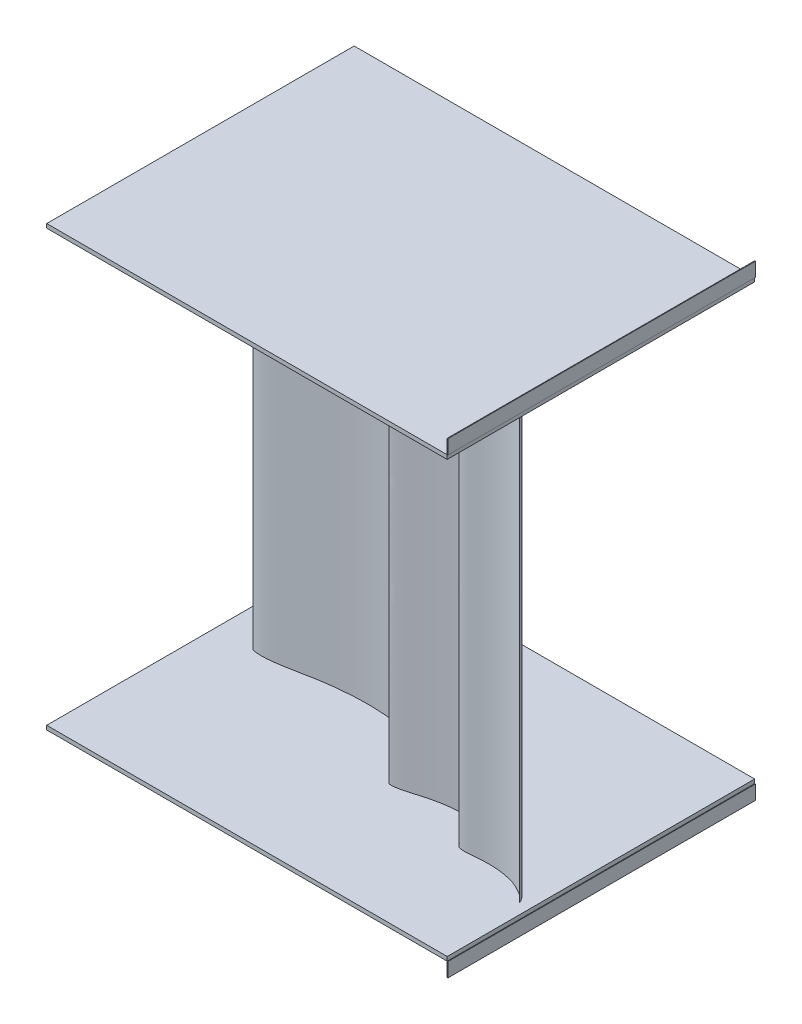
from build123d import *

# Parameters (mm, degrees)
SKETCH7_W             = 787.4
SKETCH7_H             = 604.52
BOSS_EXTRUDE10_DEPTH  = 8
SKETCH10_W            = 1.27
SKETCH10_H            = 604.52
EXTRUDE_THIN1_DEPTH   = 28
BOSS_EXTRUDE8_DEPTH   = 423.165
BOSS_EXTRUDE8_2_DEPTH = 423.165
BOSS_EXTRUDE8_3_DEPTH = 423.165


with BuildPart() as part:
    # Sketch7 → Boss-Extrude10 (new body)
    with BuildSketch(Plane(origin=(0, -431.165, 0), x_dir=(1, 0, 0), z_dir=(0, 1, 0))):
        with Locations((1635.15, -891.39)):
            Rectangle(SKETCH7_W, SKETCH7_H)
    extrude(amount=BOSS_EXTRUDE10_DEPTH)


with BuildPart() as body_2:
    # Sketch10 → Extrude-Thin1 (new body)
    with BuildSketch(Plane(origin=(0, -431.165, 0), x_dir=(1, 0, 0), z_dir=(0, 1, 0))):
        with Locations((2029.485, -891.39)):
            Rectangle(SKETCH10_W, SKETCH10_H)
    extrude(amount=-EXTRUDE_THIN1_DEPTH)


with BuildPart() as body_3:
    # Sketch8 → Boss-Extrude8 (new body)
    with BuildSketch(Plane(origin=(0, 0, 0), x_dir=(1, 0, 0), z_dir=(0, 1, 0))):
        with BuildLine():
            add(Edge.make_bspline(
                [(1676.223645231, -953.14898116), (1676.248508517, -952.823118075), (1676.298611544, -952.166458019), (1676.513196004, -951.187762742), (1676.829208496, -950.208835252), (1677.25637938, -949.227625696), (1677.791055972, -948.241521318), (1678.433356312, -947.248262064), (1679.182336331, -946.245882785), (1680.03734564, -945.232886883), (1680.997586788, -944.208299611), (1682.06220163, -943.171712889), (1683.230217195, -942.123302689), (1684.500543999, -941.063831428), (1685.871968022, -939.994637546), (1687.343150149, -938.917612884), (1688.912627259, -937.835169311), (1690.578815096, -936.750194869), (1692.340013179, -935.666001169), (1694.194407048, -934.586258263), (1696.14007544, -933.514927699), (1698.174993183, -932.45618329), (1700.297037784, -931.414332042), (1703.278410338, -930.035603138), (1707.208201868, -928.383622165), (1712.176217772, -926.560628741), (1716.517165062, -925.190554331), (1721.06969434, -923.919700166), (1724.841313656, -923.002005561), (1729.702381746, -921.979803058), (1734.737738875, -921.082158021), (1740.936332451, -920.215366906), (1746.219538682, -919.656314347), (1750.525929003, -919.295337438), (1753.807850357, -919.064889582), (1757.12155907, -918.873639774), (1760.463910355, -918.718987206), (1763.831730564, -918.598345139), (1767.221816129, -918.509221677), (1770.630933216, -918.449298875), (1774.05581721, -918.416511403), (1777.493173053, -918.409107807), (1782.09178083, -918.43128741), (1786.695818413, -918.499581485), (1791.300387742, -918.612547766), (1794.749648561, -918.721787809), (1798.191195671, -918.850634395), (1801.621845547, -919.023030396), (1805.033816623, -919.312642062), (1808.42447133, -919.694023237), (1811.790575279, -920.164944551), (1815.129197673, -920.716379976), (1818.437387417, -921.340819211), (1821.712245171, -922.030355712), (1824.95088947, -922.777478624), (1828.150453059, -923.575117575), (1831.308073784, -924.416851652), (1834.420890312, -925.297032368), (1837.486038879, -926.210886979), (1840.500653879, -927.154574468), (1843.461869792, -928.125205237), (1846.366825338, -929.120819915), (1849.212669272, -930.140327984), (1851.996568306, -931.183410024), (1854.715714803, -932.250388532), (1857.367336775, -933.342069149), (1859.948707482, -934.459560057), (1862.45715598, -935.60407605), (1864.890078481, -936.776731787), (1867.244949183, -937.978336775), (1869.519332636, -939.209192938), (1871.710896618, -940.468906962), (1873.817423668, -941.756224411), (1875.836824072, -943.068888789), (1877.767146459, -944.403534536), (1879.606587849, -945.755615734), (1881.353499776, -947.119375978), (1883.006392478, -948.487858077), (1884.563935543, -949.852954837), (1886.024954137, -951.205501046), (1887.797220612, -952.934131788), (1889.758801693, -954.990699237), (1892.016491851, -957.570442316), (1893.782138215, -959.768588407), (1894.979030644, -961.359539906), (1895.519158005, -962.097619563), (1895.774301262, -962.450663626), (1895.927431935, -962.664273144), (1895.99551792, -962.759699416), (1896.012575767, -962.783606932)],
                knots=[0, 0, 0, 0, 0.004018004, 0.008096844, 0.012294289, 0.016662584, 0.021246956, 0.026085061, 0.031207156, 0.036636683, 0.042391044, 0.048482393, 0.054918383, 0.061702826, 0.068836278, 0.076316544, 0.084139133, 0.092297662, 0.100784228, 0.109589757, 0.118704313, 0.128117401, 0.13781823, 0.147795954, 0.168539602, 0.190267252, 0.212905888, 0.224546433, 0.248433347, 0.260666031, 0.285676528, 0.311368314, 0.337682338, 0.351052217, 0.364551981, 0.378171871, 0.391901548, 0.405730116, 0.419646162, 0.433637803, 0.447692751, 0.461798364, 0.475941717, 0.504288898, 0.518466032, 0.532627656, 0.546760426, 0.560851801, 0.574897718, 0.588895404, 0.602839786, 0.616723549, 0.630537309, 0.644269913, 0.657908804, 0.671440457, 0.684850808, 0.698125672, 0.711251123, 0.724213822, 0.737001283, 0.749602075, 0.762005976, 0.774204054, 0.78618871, 0.797953651, 0.80949382, 0.820805253, 0.831884876, 0.842730218, 0.853339058, 0.863708983, 0.873836886, 0.883718414, 0.893347394, 0.902715279, 0.911810645, 0.920618786, 0.929121449, 0.937296719, 0.9451191, 0.959587072, 0.972264254, 0.987301179, 0.99427769, 0.996765345, 0.998557281, 0.99963855, 1, 1, 1, 1], degree=3))
            add(Edge.make_bspline(
                [(1896.012575767, -962.783606932), (1895.406108271, -961.981251513), (1894.525610697, -960.816354786), (1893.020166109, -959.473634815), (1891.95141706, -958.572815175), (1890.983489394, -957.615047027), (1889.930145969, -956.875333931), (1888.827154409, -956.06134552), (1887.548867429, -955.237517425), (1886.282522999, -954.294903774), (1884.723276336, -953.591355875), (1883.235195013, -952.669606729), (1881.630330044, -951.882238334), (1879.97306751, -951.058374307), (1878.294628507, -950.322892903), (1876.640310248, -949.547798047), (1875.064466368, -948.801245623), (1873.439801753, -948.068004121), (1871.755033673, -947.330648276), (1870.006899089, -946.594716844), (1868.208781824, -945.832569804), (1866.322925943, -945.08275469), (1864.335183936, -944.331601323), (1862.246667966, -943.575703932), (1860.043381221, -942.793960025), (1857.723676247, -942.055434755), (1855.339209461, -941.27192839), (1852.893583799, -940.50876702), (1850.390693067, -939.833574641), (1847.875994884, -939.166485208), (1845.358172989, -938.536928922), (1842.840694672, -937.942623999), (1840.315956742, -937.420454986), (1837.787507618, -936.966659322), (1835.26189299, -936.538253028), (1832.724498497, -936.229692535), (1830.196694703, -935.876305678), (1827.661559054, -935.598508546), (1825.122957409, -935.379313532), (1822.585239267, -935.178638192), (1820.047244639, -934.978303084), (1817.505340863, -934.863183594), (1814.963546418, -934.736730875), (1812.41968749, -934.689062974), (1809.876512993, -934.574975628), (1807.329571764, -934.568706561), (1804.780990253, -934.593091769), (1802.231520733, -934.637443114), (1799.681459161, -934.716283297), (1797.13080349, -934.809467905), (1794.576178629, -934.888995966), (1792.02367551, -935.06218139), (1789.468598076, -935.229592288), (1786.909632238, -935.392745345), (1784.35487952, -935.645655121), (1781.795635471, -935.884747249), (1779.231783491, -936.130235621), (1776.677078059, -936.483951013), (1774.110498608, -936.776345632), (1771.549831919, -937.130933735), (1768.983555884, -937.480988172), (1766.419047081, -937.880828468), (1763.852324187, -938.30909418), (1761.283554199, -938.758565105), (1758.71571749, -939.237471636), (1756.145988074, -939.724220739), (1753.590328662, -940.214044341), (1751.065608548, -940.783225469), (1748.570201184, -941.321840744), (1746.140880191, -941.882678592), (1743.787176739, -942.425858985), (1741.519296493, -942.993729831), (1739.307962225, -943.55928887), (1737.140019015, -944.143347827), (1735.014757571, -944.733219354), (1732.919909018, -945.286078616), (1730.890959026, -945.860661174), (1728.911257345, -946.467284808), (1726.936206075, -947.025079769), (1724.991375225, -947.613560944), (1723.065551081, -948.201526741), (1721.162736401, -948.784816312), (1719.227425393, -949.332611381), (1717.288196016, -949.934656202), (1715.313992462, -950.501428944), (1713.352394589, -951.102297675), (1711.380304796, -951.665965275), (1709.395675862, -952.252599545), (1707.366164454, -952.82770925), (1705.27994173, -953.413041526), (1703.112772334, -953.99096574), (1700.859571532, -954.533532892), (1698.515014852, -955.097855994), (1696.060719434, -955.603355076), (1693.533964532, -956.104483714), (1690.966854221, -956.543428554), (1688.405511493, -956.906909649), (1685.842066717, -957.129367476), (1683.293887702, -957.254836649), (1680.721811473, -957.261305317), (1678.77111711, -957.051423213), (1677.197097894, -956.860976979), (1676.657693201, -955.994402193), (1676.134030965, -954.818154504), (1676.187168697, -953.828400425), (1676.223645231, -953.14898116)],
                knots=[0, 0, 0, 0, 0.012969613, 0.018829885, 0.026053492, 0.031072711, 0.036411959, 0.042675167, 0.048818841, 0.056098654, 0.063029013, 0.07086949, 0.078731271, 0.086149516, 0.094824955, 0.102443262, 0.109795749, 0.117394239, 0.125513288, 0.133598644, 0.141944087, 0.150790562, 0.159864361, 0.169446736, 0.179539205, 0.190121069, 0.200953426, 0.212027043, 0.223274914, 0.234503092, 0.245701924, 0.25686608, 0.267981226, 0.279066442, 0.290115737, 0.301130877, 0.312145186, 0.32315148, 0.334135085, 0.345124319, 0.356101573, 0.367083907, 0.378056416, 0.389039746, 0.400012846, 0.411002081, 0.421999334, 0.433002579, 0.44400471, 0.455020626, 0.466039585, 0.47708247, 0.488130432, 0.499183673, 0.510267601, 0.521355417, 0.53245533, 0.543598587, 0.554732331, 0.56588871, 0.577056981, 0.588255725, 0.599481242, 0.610738121, 0.622008749, 0.633290144, 0.644591394, 0.655686241, 0.666785959, 0.677634095, 0.687956368, 0.698050747, 0.707893271, 0.717499459, 0.727111021, 0.736440914, 0.745541675, 0.754402961, 0.763239649, 0.772104051, 0.780701957, 0.789302509, 0.797863114, 0.806733775, 0.815582689, 0.824447091, 0.833286822, 0.842129605, 0.85123336, 0.86058942, 0.870175174, 0.88026153, 0.890586373, 0.901385732, 0.912691745, 0.92392719, 0.935090318, 0.946170428, 0.957198422, 0.968178171, 0.979173028, 0.983281921, 0.987500047, 0.991419375, 1, 1, 1, 1], degree=3))
        make_face()
    extrude(amount=-BOSS_EXTRUDE8_DEPTH)


with BuildPart() as body_4:
    # Sketch8 → Boss-Extrude8 2 (new body)
    with BuildSketch(Plane(origin=(0, 0, 0), x_dir=(1, 0, 0), z_dir=(0, 1, 0))):
        with BuildLine():
            add(Edge.make_bspline(
                [(2008.92647858, -1031.598430351), (2008.60933723, -1030.93928668), (2008.148896743, -1029.982311398), (2007.268440658, -1028.808798243), (2006.635857931, -1028.013058732), (2006.083335074, -1027.191198414), (2005.438596634, -1026.512532397), (2004.769129471, -1025.773781045), (2003.976098752, -1025.002837451), (2003.208643205, -1024.148921011), (2002.198026994, -1023.423377914), (2001.269487533, -1022.552489551), (2000.238386603, -1021.760634676), (1999.175170587, -1020.935234585), (1998.084162741, -1020.169805347), (1997.016041306, -1019.37959809), (1995.9997687, -1018.621011137), (1994.946777572, -1017.864902256), (1993.851526632, -1017.097227614), (1992.710893988, -1016.321467407), (1991.538391466, -1015.519837961), (1990.301564546, -1014.714398979), (1988.992290164, -1013.893372357), (1987.611850396, -1013.054489687), (1986.153297093, -1012.180695646), (1984.60553613, -1011.320993586), (1983.018063732, -1010.419920772), (1981.384066061, -1009.524568885), (1979.696606617, -1008.683709679), (1977.99956526, -1007.846931604), (1976.294906104, -1007.036464122), (1974.585428877, -1006.251178431), (1972.860415293, -1005.516279334), (1971.122935601, -1004.829593962), (1969.383830177, -1004.161417039), (1967.619113288, -1003.576992228), (1965.867672332, -1002.961985958), (1964.100147455, -1002.399818302), (1962.321734688, -1001.878933192), (1960.541291902, -1001.371378571), (1958.760603128, -1000.864026806), (1956.96488812, -1000.416868023), (1955.17087881, -999.961644923), (1953.364082051, -999.56229491), (1951.56731284, -999.115689485), (1949.752372591, -998.745412054), (1947.931860142, -998.396753986), (1946.107846925, -998.062203226), (1944.278458097, -997.752156234), (1942.44658547, -997.452250766), (1940.61384445, -997.142038787), (1938.769164459, -996.898904523), (1936.923478486, -996.651283575), (1935.075631815, -996.400068522), (1933.217897454, -996.2134506), (1931.358945579, -996.016336317), (1929.495789814, -995.823120413), (1927.623610822, -995.708378602), (1925.751773533, -995.54821275), (1923.875219122, -995.433236945), (1921.995316683, -995.314223214), (1920.10952363, -995.230958111), (1918.218069403, -995.167640894), (1916.322110073, -995.119147908), (1914.422588396, -995.091775068), (1912.520590913, -995.069721744), (1910.628183054, -995.051881206), (1908.746435523, -995.095062281), (1906.889976566, -995.120661528), (1905.077442111, -995.171596093), (1903.321355225, -995.220802456), (1901.622909758, -995.299938342), (1899.965110757, -995.38554752), (1898.335590316, -995.490578305), (1896.735664985, -995.605883386), (1895.162738447, -995.699168682), (1893.633674222, -995.817406363), (1892.135119617, -995.965561071), (1890.646893603, -996.079571319), (1889.175805877, -996.21979974), (1887.718342995, -996.362390585), (1886.27795633, -996.504952283), (1884.819499368, -996.617540863), (1883.350457112, -996.768243998), (1881.861546032, -996.888776705), (1880.376725084, -997.035428642), (1878.889766989, -997.154051132), (1877.3905705, -997.287246748), (1875.861030301, -997.405779624), (1874.289589564, -997.523455438), (1872.661501925, -997.624223601), (1870.977156438, -997.687427584), (1869.22455409, -997.75302135), (1867.402162234, -997.760915181), (1865.528738133, -997.755286013), (1863.635473893, -997.699526833), (1861.757160231, -997.590794184), (1859.897602575, -997.381217149), (1858.062858764, -997.10468466), (1856.228169053, -996.739878543), (1854.867566951, -996.310072053), (1853.772723729, -995.948222838), (1853.512618369, -995.252925984), (1853.308213781, -994.339109), (1853.488253081, -993.641096234), (1853.611841528, -993.161943555)],
                knots=[0, 0, 0, 0, 0.012969613, 0.018829885, 0.026053492, 0.031072711, 0.036411959, 0.042675167, 0.048818841, 0.056098654, 0.063029013, 0.07086949, 0.078731271, 0.086149516, 0.094824955, 0.102443262, 0.109795749, 0.117394239, 0.125513288, 0.133598644, 0.141944087, 0.150790562, 0.159864361, 0.169446736, 0.179539205, 0.190121069, 0.200953426, 0.212027043, 0.223274914, 0.234503092, 0.245701924, 0.25686608, 0.267981226, 0.279066442, 0.290115737, 0.301130877, 0.312145186, 0.32315148, 0.334135085, 0.345124319, 0.356101573, 0.367083907, 0.378056416, 0.389039746, 0.400012846, 0.411002081, 0.421999334, 0.433002579, 0.44400471, 0.455020626, 0.466039585, 0.47708247, 0.488130432, 0.499183673, 0.510267601, 0.521355417, 0.53245533, 0.543598587, 0.554732331, 0.56588871, 0.577056981, 0.588255725, 0.599481242, 0.610738121, 0.622008749, 0.633290144, 0.644591394, 0.655686241, 0.666785959, 0.677634095, 0.687956368, 0.698050747, 0.707893271, 0.717499459, 0.727111021, 0.736440914, 0.745541675, 0.754402961, 0.763239649, 0.772104051, 0.780701957, 0.789302509, 0.797863114, 0.806733775, 0.815582689, 0.824447091, 0.833286822, 0.842129605, 0.85123336, 0.86058942, 0.870175174, 0.88026153, 0.890586373, 0.901385732, 0.912691745, 0.92392719, 0.935090318, 0.946170428, 0.957198422, 0.968178171, 0.979173028, 0.983281921, 0.987500047, 0.991419375, 1, 1, 1, 1], degree=3))
            add(Edge.make_bspline(
                [(1853.611841528, -993.161943555), (1853.676370326, -992.933190632), (1853.806404952, -992.472221243), (1854.099959293, -991.805280852), (1854.465860057, -991.152742645), (1854.911338913, -990.514542715), (1855.434166944, -989.888293678), (1856.034752908, -989.272401181), (1856.712705978, -988.665328582), (1857.467777413, -988.065915467), (1858.299538668, -987.473352355), (1859.207436541, -986.887225055), (1860.190752077, -986.307519282), (1861.248599028, -985.73462212), (1862.379919621, -985.169313446), (1863.583487419, -984.612749714), (1864.857912881, -984.066440322), (1866.201651712, -983.532216759), (1867.613015923, -983.012195802), (1869.090184779, -982.508733407), (1870.631219532, -982.024378016), (1872.234076867, -981.561814478), (1873.896624956, -981.123808626), (1876.22021505, -980.569048142), (1879.259226245, -979.95569068), (1883.063000956, -979.369526355), (1886.354656258, -979.016206862), (1889.782908206, -978.764015151), (1892.603687709, -978.651449139), (1896.216199336, -978.620847831), (1899.935080522, -978.704082214), (1904.478859195, -978.976385307), (1908.325813486, -979.336616717), (1911.447898409, -979.69776956), (1913.820841211, -980.004842285), (1916.210816924, -980.344426744), (1918.615957018, -980.714217019), (1921.034370366, -981.111913073), (1923.464130887, -981.535278196), (1925.903265939, -981.982195345), (1928.349744652, -982.450723159), (1930.80146937, -982.939139683), (1934.076859227, -983.615433927), (1937.349497008, -984.325385328), (1940.61609779, -985.06726213), (1943.059557055, -985.640549555), (1945.494700817, -986.226707564), (1947.915820557, -986.842348979), (1950.306787996, -987.538876485), (1952.669377417, -988.29776943), (1955.001603062, -989.116973842), (1957.302671795, -989.989633679), (1959.571558311, -990.909970621), (1961.807331117, -991.871931277), (1964.009014628, -992.869746933), (1966.175580129, -993.897964958), (1968.305909261, -994.951596483), (1970.398773309, -996.026203459), (1972.452816045, -997.117971847), (1974.46654611, -998.223751621), (1976.438335552, -999.341071079), (1978.366425843, -1000.468122331), (1980.248940814, -1001.60371838), (1982.083906351, -1002.747224562), (1983.869274433, -1003.898467548), (1985.60295306, -1005.057623591), (1987.282839039, -1006.225091136), (1988.906853646, -1007.401352652), (1990.472980417, -1008.586828862), (1991.979302316, -1009.781734132), (1993.424039626, -1010.985933925), (1994.80558608, -1012.198812857), (1996.122540911, -1013.419158094), (1997.373738349, -1014.64506073), (1998.55827055, -1015.873841023), (1999.675504993, -1017.101999005), (2000.725093176, -1018.325193888), (2001.70697221, -1019.538251576), (2002.621357985, -1020.735200967), (2003.468729271, -1021.909338989), (2004.483988946, -1023.396309718), (2005.587120031, -1025.144273349), (2006.826220143, -1027.307763889), (2007.769325231, -1029.128524561), (2008.394146597, -1030.434698052), (2008.673222469, -1031.038488153), (2008.80442031, -1031.326836064), (2008.882914799, -1031.501122479), (2008.917750945, -1031.578935541), (2008.92647858, -1031.598430351)],
                knots=[0, 0, 0, 0, 0.004018004, 0.008096844, 0.012294289, 0.016662584, 0.021246956, 0.026085061, 0.031207156, 0.036636683, 0.042391044, 0.048482393, 0.054918383, 0.061702826, 0.068836278, 0.076316544, 0.084139133, 0.092297662, 0.100784228, 0.109589757, 0.118704313, 0.128117401, 0.13781823, 0.147795954, 0.168539602, 0.190267252, 0.212905888, 0.224546433, 0.248433347, 0.260666031, 0.285676528, 0.311368314, 0.337682338, 0.351052217, 0.364551981, 0.378171871, 0.391901548, 0.405730116, 0.419646162, 0.433637803, 0.447692751, 0.461798364, 0.475941717, 0.504288898, 0.518466032, 0.532627656, 0.546760426, 0.560851801, 0.574897718, 0.588895404, 0.602839786, 0.616723549, 0.630537309, 0.644269913, 0.657908804, 0.671440457, 0.684850808, 0.698125672, 0.711251123, 0.724213822, 0.737001283, 0.749602075, 0.762005976, 0.774204054, 0.78618871, 0.797953651, 0.80949382, 0.820805253, 0.831884876, 0.842730218, 0.853339058, 0.863708983, 0.873836886, 0.883718414, 0.893347394, 0.902715279, 0.911810645, 0.920618786, 0.929121449, 0.937296719, 0.9451191, 0.959587072, 0.972264254, 0.987301179, 0.99427769, 0.996765345, 0.998557281, 0.99963855, 1, 1, 1, 1], degree=3))
        make_face()
    extrude(amount=-BOSS_EXTRUDE8_2_DEPTH)


with BuildPart() as body_5:
    # Sketch8 → Boss-Extrude8 3 (new body)
    with BuildSketch(Plane(origin=(0, 0, 0), x_dir=(1, 0, 0), z_dir=(0, 1, 0))):
        with BuildLine():
            add(Edge.make_bspline(
                [(1314.075266142, -855), (1314.082536869, -855.118118311), (1314.161247856, -856.396836206), (1313.556629056, -858.307280968), (1314.377691946, -860.551987174), (1315.2321768, -862.322250522), (1318.227491231, -862.98940319), (1321.933479198, -863.766730794), (1326.880249726, -864.246846688), (1331.802314331, -864.493738462), (1336.772721177, -864.557083849), (1341.765984188, -864.348945445), (1346.784818701, -863.996845647), (1351.737979912, -863.517481155), (1356.552691545, -863.015836882), (1361.167718547, -862.380096738), (1366.986320297, -861.577979508), (1372.593658088, -860.598883507), (1378.013543243, -859.630397605), (1381.940954594, -858.882830945), (1385.8398631, -858.177011465), (1389.725728203, -857.397670712), (1393.629294726, -856.686287071), (1397.472386131, -855.900401234), (1401.29755468, -855.218049196), (1405.067053882, -854.461241987), (1408.881679821, -853.699852725), (1412.732941062, -852.941113145), (1416.636417616, -852.247149855), (1420.558185914, -851.460213917), (1424.568487341, -850.744303173), (1428.701304855, -850.082772813), (1432.899674104, -849.355918828), (1437.178977216, -848.64841328), (1441.538147624, -847.984780904), (1446.006459143, -847.327534919), (1450.635019588, -846.734189296), (1455.412321594, -846.121383944), (1460.312405087, -845.563954709), (1465.27469082, -844.953383073), (1470.281251643, -844.501286273), (1475.314270368, -844.05779444), (1480.342148636, -843.62901587), (1485.366183081, -843.257000114), (1490.382220915, -842.925355053), (1495.388558222, -842.647928097), (1500.388757082, -842.466542973), (1505.37904144, -842.275368414), (1510.368779845, -842.204880867), (1515.347437727, -842.014242147), (1520.322949058, -842.033400076), (1525.288377479, -842.063970938), (1530.247818739, -842.0671199), (1535.198167577, -842.243615143), (1540.141857249, -842.411180784), (1545.081704323, -842.56715299), (1550.007691623, -842.903569118), (1554.928664615, -843.21297304), (1559.845748153, -843.549837458), (1564.755087867, -843.95288637), (1569.658896403, -844.394146102), (1574.553680546, -844.894018377), (1579.420573226, -845.600428269), (1584.301503051, -846.179291158), (1589.163374491, -846.90920668), (1594.027626777, -847.617357278), (1598.868042973, -848.488569124), (1603.707862514, -849.360382039), (1608.5458333, -850.267964542), (1613.36591721, -851.287534041), (1618.157429229, -852.451005374), (1622.97596314, -853.53014392), (1627.748898289, -854.837405813), (1632.522419305, -856.194016588), (1637.275710597, -857.681350631), (1642.001230388, -859.305961077), (1646.720658866, -860.998401021), (1651.426893827, -862.762392639), (1657.620576721, -865.113547336), (1663.579986364, -867.782851019), (1669.415246183, -870.301941731), (1673.500894945, -872.226688316), (1678.561731489, -874.649993828), (1683.341214986, -877.057450653), (1687.840148281, -879.516470649), (1691.059632653, -881.265975623), (1694.157034781, -883.006082022), (1697.139688052, -884.72676767), (1700.02594376, -886.46369016), (1703.057583963, -888.270510134), (1706.143178721, -890.005801073), (1709.171137837, -891.906933943), (1712.105363209, -893.727875443), (1714.789357147, -895.784769219), (1717.651944778, -897.435845212), (1719.905697686, -899.490377071), (1722.205159015, -901.318854848), (1724.169534592, -903.094843086), (1726.052697678, -904.718542676), (1727.729901496, -906.745049603), (1729.611821722, -908.68139496), (1732.248563596, -911.550846535), (1733.718028767, -913.95877103), (1734.730164278, -915.617296825)],
                knots=[0, 0, 0, 0, 0.000793001, 0.008584826, 0.012504137, 0.016722246, 0.020831121, 0.031825931, 0.042805634, 0.053833581, 0.064913644, 0.076076725, 0.087312122, 0.098618087, 0.109417401, 0.119742199, 0.129828513, 0.148770247, 0.157873963, 0.166716709, 0.175556402, 0.184420767, 0.193269643, 0.202140266, 0.210700835, 0.219301351, 0.22789922, 0.236763585, 0.245600235, 0.254461484, 0.263562206, 0.27289206, 0.282503581, 0.292109729, 0.301952211, 0.312046547, 0.322368776, 0.333216866, 0.344316537, 0.355411337, 0.366712539, 0.377993886, 0.389264467, 0.400521298, 0.411746768, 0.422945464, 0.434113688, 0.44527002, 0.456403717, 0.467546926, 0.478646792, 0.489734561, 0.500818442, 0.511871636, 0.522919552, 0.53396239, 0.544981302, 0.555997172, 0.566999256, 0.578002454, 0.588999661, 0.599988849, 0.610961903, 0.621945186, 0.632917649, 0.643899935, 0.654877143, 0.665866331, 0.676849889, 0.687856137, 0.698870399, 0.709885492, 0.720934741, 0.73201991, 0.743135008, 0.754299118, 0.765497902, 0.776726032, 0.787973856, 0.809879737, 0.820461556, 0.830553982, 0.840136316, 0.858056515, 0.866401922, 0.874487244, 0.882606258, 0.890204717, 0.897557172, 0.905175447, 0.913850849, 0.921269063, 0.929130811, 0.936971254, 0.943901584, 0.951181366, 0.957325014, 0.963588196, 0.968927421, 0.973946618, 0.981170195, 0.987030442, 1, 1, 1, 1], degree=3))
            add(Edge.make_bspline(
                [(1734.730164278, -915.617296825), (1734.042262873, -913.961502062), (1732.985888314, -911.418783802), (1731.111491116, -908.168669164), (1729.209004537, -905.744025702), (1727.221891243, -903.278593797), (1724.864967941, -901.193487629), (1722.653753885, -899.073111411), (1720.239055245, -897.140321934), (1717.753224197, -895.123472863), (1715.301557932, -893.177151072), (1713.00803545, -891.413860227), (1710.841316416, -889.823902036), (1708.684335468, -888.158781211), (1706.248692214, -886.592082348), (1703.784585669, -884.863928967), (1701.214007996, -883.178293629), (1698.583440643, -881.374353965), (1695.839057498, -879.607830535), (1693.086264469, -877.892237238), (1690.353302761, -876.173073054), (1687.54287638, -874.516846134), (1683.759129019, -872.21139395), (1679.86863653, -869.942245037), (1675.872462353, -867.639337892), (1672.684875892, -865.90844924), (1669.410681469, -864.105457331), (1666.024534477, -862.348490995), (1662.653296677, -860.503027523), (1659.135605082, -858.778135996), (1655.557631061, -856.932928144), (1651.799752885, -855.095104524), (1647.943957882, -853.209748499), (1643.955408115, -851.350739912), (1639.805612306, -849.484284101), (1635.555549868, -847.565241783), (1631.197414348, -845.609010532), (1626.738121118, -843.706736592), (1622.206016876, -841.79323946), (1617.625995386, -839.818258369), (1612.939687206, -838.027086712), (1608.251727034, -836.168666136), (1603.549725517, -834.368799559), (1597.247141451, -832.093905595), (1590.987145604, -829.733406548), (1584.681747422, -827.531284492), (1579.930102221, -826.005938732), (1575.182651707, -824.494901749), (1570.426848528, -823.00798727), (1564.143646686, -820.883865019), (1557.760270991, -819.105232448), (1551.410594817, -817.262296213), (1546.630107774, -815.97347462), (1541.833934873, -814.76917197), (1537.048719482, -813.53751137), (1532.254223079, -812.359006189), (1527.458674329, -811.197577401), (1522.643353561, -810.141655575), (1517.824142459, -809.124792869), (1513.004542384, -808.123040298), (1508.167056614, -807.224978991), (1503.33107408, -806.325733984), (1498.479627494, -805.528729888), (1493.609885156, -804.854258857), (1488.745307909, -804.142007882), (1483.86288232, -803.559232192), (1478.978467345, -802.975918697), (1474.076609359, -802.543371963), (1469.177035671, -802.06371684), (1464.266873104, -801.670955268), (1459.348934181, -801.333005512), (1454.421149636, -801.040609506), (1449.482002412, -800.838694565), (1444.53219704, -800.709181935), (1439.572026743, -800.653972498), (1434.600765457, -800.658232038), (1429.622399953, -800.779586633), (1424.626346559, -800.852140801), (1419.625706698, -801.181967779), (1414.601892111, -801.487783229), (1409.568279865, -801.938545055), (1404.599332947, -802.475272442), (1399.819850426, -803.094326554), (1395.386427649, -803.730991333), (1391.295436713, -804.400141808), (1387.492049487, -805.198503946), (1383.852873934, -805.936994372), (1379.395528153, -807.055828452), (1375.16173735, -808.170095835), (1371.177910151, -809.354581704), (1368.360669203, -810.255987352), (1365.668055301, -811.218567441), (1363.04422409, -812.176722735), (1360.488286048, -813.13388259), (1358.010998282, -814.13163169), (1355.606475212, -815.180911568), (1353.293022308, -816.300151911), (1351.029488664, -817.391215708), (1348.894641295, -818.494175175), (1346.949334486, -819.587740311), (1345.030152889, -820.588901712), (1343.184543839, -821.684573879), (1341.41022047, -822.790669179), (1339.737950873, -823.869894542), (1338.204661936, -825.009099225), (1336.56420323, -826.057975675), (1335.024551393, -827.2713561), (1333.406331056, -828.397692337), (1331.983467791, -829.65922634), (1330.55788938, -830.833237032), (1329.212767851, -832.062790427), (1327.818740181, -833.326809769), (1326.490687646, -834.665696413), (1324.82878191, -836.416068209), (1323.318117212, -838.203318473), (1321.793895089, -839.896580681), (1320.808422534, -841.192721674), (1319.829819541, -842.484523081), (1318.958223039, -843.9039549), (1318.020973155, -845.365822969), (1317.193201804, -847.007697485), (1316.24537081, -848.631754219), (1315.412251662, -850.382057407), (1314.592880584, -852.104764059), (1314.359588072, -853.707287846), (1314.150533835, -854.657784183), (1314.075266142, -855)],
                knots=[0, 0, 0, 0, 0.011425693, 0.017545845, 0.023852036, 0.031066993, 0.037692923, 0.043880895, 0.050604916, 0.057403177, 0.064302713, 0.070569037, 0.075853505, 0.081445181, 0.087939485, 0.094312163, 0.100641248, 0.107543812, 0.114655512, 0.121455599, 0.128232841, 0.135247385, 0.142260608, 0.156493085, 0.163973232, 0.171676471, 0.179627227, 0.187812619, 0.196007177, 0.204136374, 0.212797106, 0.221683675, 0.230816581, 0.240172328, 0.249749165, 0.259838553, 0.269915533, 0.28021716, 0.290759178, 0.301294305, 0.312024894, 0.322753417, 0.333459691, 0.344135173, 0.365489907, 0.376129537, 0.386730052, 0.397318483, 0.407906913, 0.418510524, 0.439617326, 0.450158558, 0.460680219, 0.471194463, 0.481698763, 0.492195661, 0.50268482, 0.513168709, 0.523636598, 0.534099993, 0.544564519, 0.555017082, 0.565473347, 0.575918686, 0.586373123, 0.596829564, 0.60727942, 0.617746033, 0.628213536, 0.638679115, 0.64916233, 0.659654907, 0.670163512, 0.680689862, 0.691235249, 0.701801871, 0.712394812, 0.722998133, 0.733664178, 0.744352245, 0.755100426, 0.765893746, 0.776227907, 0.785837306, 0.794461427, 0.802660806, 0.810622254, 0.818142619, 0.831966357, 0.838544155, 0.844650203, 0.850829798, 0.856780682, 0.862466875, 0.868236652, 0.87381291, 0.879195948, 0.884626831, 0.889839901, 0.89451862, 0.898859473, 0.903643274, 0.908202718, 0.912196994, 0.916332264, 0.9203809, 0.924604197, 0.928827533, 0.932942615, 0.936719282, 0.940606508, 0.944563469, 0.948719919, 0.952630609, 0.959956259, 0.963643137, 0.967152201, 0.970337572, 0.973972656, 0.97776931, 0.981405325, 0.985691601, 0.98974915, 0.993788145, 0.99776349, 1, 1, 1, 1], degree=3))
        make_face()
    extrude(amount=-BOSS_EXTRUDE8_3_DEPTH)


with BuildPart() as body_6:
    # Mirror1: mirrored copy
    add(part.part.mirror(Plane.ZX))


with BuildPart() as body_7:
    # Mirror1 2: mirrored copy
    add(body_2.part.mirror(Plane.ZX))


with BuildPart() as body_8:
    # Mirror1 3: mirrored copy
    add(body_3.part.mirror(Plane.ZX))

    # Combine2: union body 3
    add(body_3.part)


with BuildPart() as body_9:
    # Mirror1 4: mirrored copy
    add(body_5.part.mirror(Plane.ZX))

    # Combine1: union body 5
    add(body_5.part)


with BuildPart() as body_10:
    # Mirror1 5: mirrored copy
    add(body_4.part.mirror(Plane.ZX))

    # Combine3: union body 4
    add(body_4.part)


solid = Compound([part.part, body_2.part, body_6.part, body_7.part, body_8.part, body_9.part, body_10.part])
